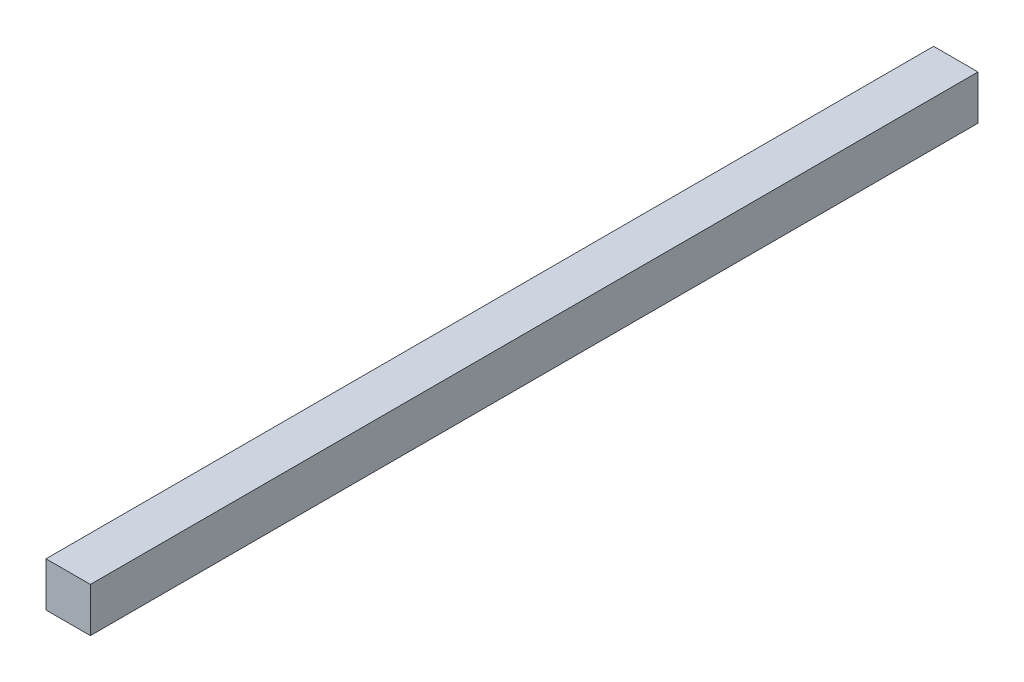
from build123d import *

# Parameters (mm, degrees)
SKETCH1_W      = 25.4
SKETCH1_H      = 25.4
EXTRUDE1_DEPTH = 508


with BuildPart() as part:
    # Sketch1 → Extrude1 (new body)
    with BuildSketch(Plane.XY):
        with Locations((12.7, 12.7)):
            Rectangle(SKETCH1_W, SKETCH1_H)
    extrude(amount=-EXTRUDE1_DEPTH)


solid = part.part
